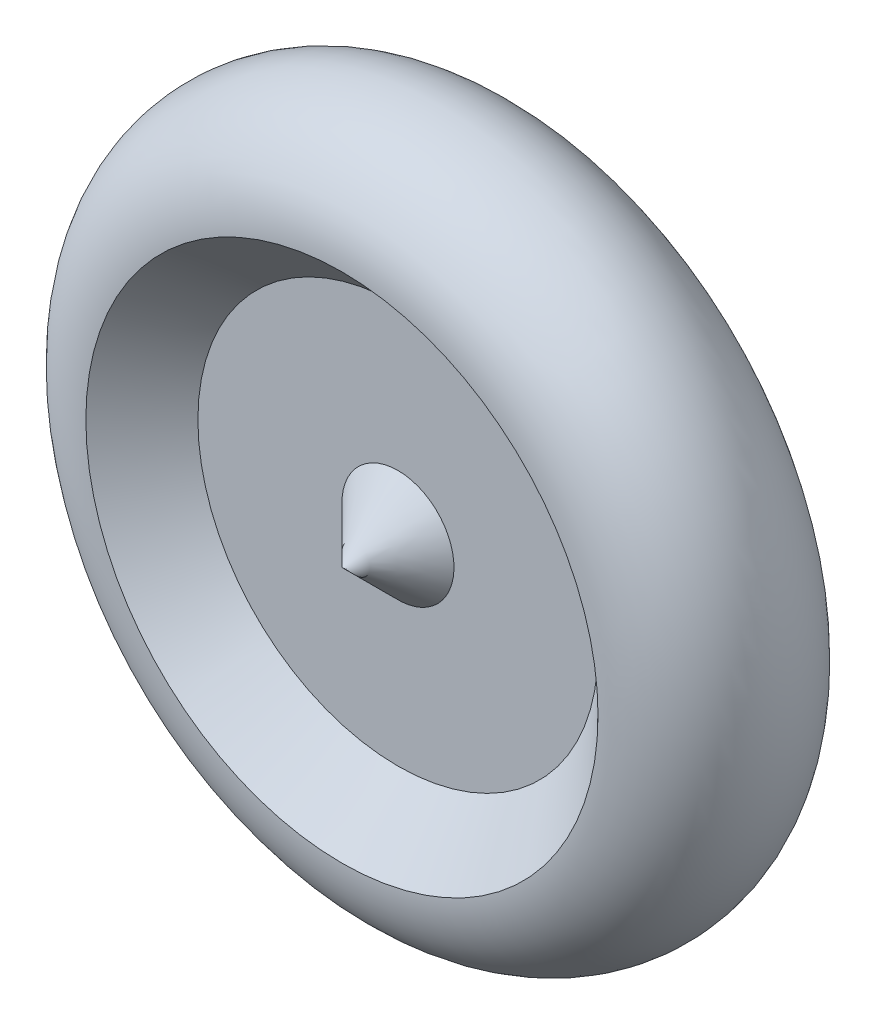
from build123d import *


with BuildPart() as part:
    # Sketch2 → Revolve1 (revolve)
    with BuildSketch(Plane(origin=(0, 0, 0), x_dir=(0, 0, -1), z_dir=(1, 0, 0))):
        with BuildLine():
            Line((30, 0), (-30, 0))
            Line((-30, 0), (-12.5, 17.5))
            Line((-12.5, 17.5), (-12.5, 62.5))
            Line((-12.5, 62.5), (-30, 80))
            ThreePointArc((-30, 80), (0, 110), (30, 80))
            Line((30, 80), (12.5, 62.5))
            Line((12.5, 62.5), (12.5, 17.5))
            Line((12.5, 17.5), (30, 0))
        make_face()
    revolve(axis=Axis((0, 0, -30), (0, 0, 1)))


solid = part.part
